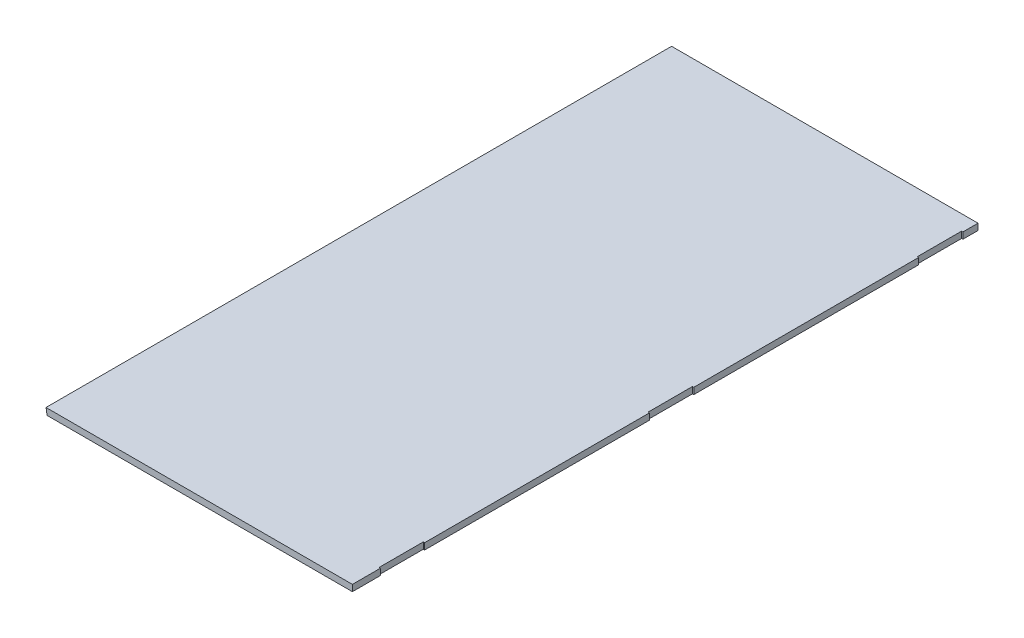
from build123d import *

# Parameters (mm, degrees)
SKETCH1_W           = 877.824
SKETCH1_H           = 1792.224
BOSS_EXTRUDE1_DEPTH = 18.25625
SKETCH2_W           = 127
SKETCH2_H           = 18.25625
CUT_EXTRUDE1_DEPTH  = 3.81
CUT_EXTRUDE2_DEPTH  = 7620


with BuildPart() as part:
    # Sketch1 → Boss-Extrude1 (new body)
    with BuildSketch(Plane(origin=(0, 0, 0), x_dir=(1, 0, 0), z_dir=(0, 1, 0))):
        Rectangle(SKETCH1_W, SKETCH1_H)
    extrude(amount=BOSS_EXTRUDE1_DEPTH)

    # Sketch2 → Cut-Extrude1 (cut)
    with BuildSketch(Plane(origin=(438.912, 0, 0), x_dir=(0, 0, -1), z_dir=(1, 0, 0))):
        with Locations((-752.856, 9.128125)):
            Rectangle(SKETCH2_W, SKETCH2_H)
        with Locations((18.288, 9.128125)):
            Rectangle(SKETCH2_W, SKETCH2_H)
        with Locations((789.432, 9.128125)):
            Rectangle(SKETCH2_W, SKETCH2_H)
    extrude(amount=-CUT_EXTRUDE1_DEPTH, mode=Mode.SUBTRACT)

    # Sketch3 → Cut-Extrude2 (cut)
    with BuildSketch(Plane(origin=(-438.912, 0, 896.112), x_dir=(1, 0, 0), z_dir=(0, 0, 1))):
        Polygon((0, 18.25625), (3.219069442, 0), (0, 0), align=None)
    extrude(amount=-CUT_EXTRUDE2_DEPTH, mode=Mode.SUBTRACT)


solid = part.part
